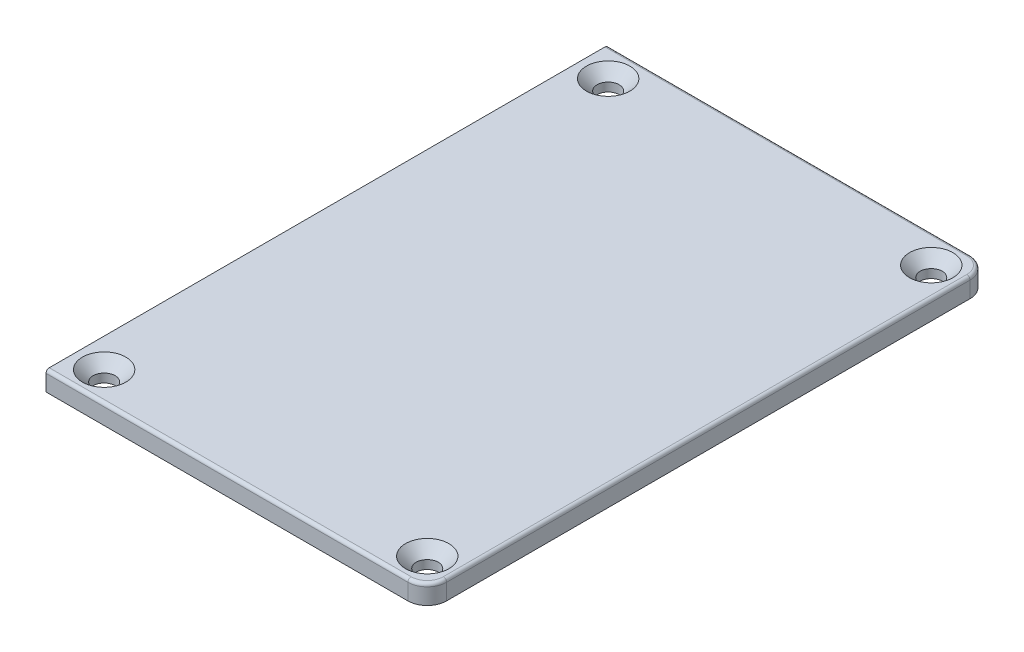
from build123d import *

# Parameters (mm, degrees)
SKETCH1_W                    = 59
SKETCH1_H                    = 87
BOSS_EXTRUDE1_DEPTH          = 1.5
CSK_FOR_M3_SFHCS1_AT_2_COUNT = 2
CSK_FOR_M3_SFHCS1_AT_2_PITCH = 78
CSK_FOR_M3_SFHCS1_AT_3_COUNT = 2
CSK_FOR_M3_SFHCS1_AT_3_PITCH = 92.649878575
CSK_FOR_M3_SFHCS1_AT_4_COUNT = 2
CSK_FOR_M3_SFHCS1_AT_4_PITCH = 50
FILLET3_R                    = 3
FILLET4_R                    = 0.5


with BuildPart() as part:
    # Sketch1 → Boss-Extrude1 (new, symmetric)
    with BuildSketch(Plane(origin=(0, 0, 0), x_dir=(1, 0, 0), z_dir=(0, 1, 0))):
        Rectangle(SKETCH1_W, SKETCH1_H)
    extrude(amount=BOSS_EXTRUDE1_DEPTH, both=True)

    # Sketch4 → CSK for M3 SFHCS1 (revolve, cut)
    with BuildSketch(Plane(origin=(-25, 1.5, -39), x_dir=(0, 0, 1), z_dir=(1, 0, 0))):
        Polygon((0, 0), (0, 3), (1.7, 3), (1.7, 1.66), (3.36, 0), align=None)
    csk_for_m3_sfhcs1 = revolve(axis=Axis((-25, 7.85, -39), (0, -1, 0)), mode=Mode.SUBTRACT)

    # CSK for M3 SFHCS1 at 2: CSK for M3 SFHCS1 ×2
    with Locations(*[(0, 0, i * CSK_FOR_M3_SFHCS1_AT_2_PITCH) for i in range(1, CSK_FOR_M3_SFHCS1_AT_2_COUNT)]):
        add(csk_for_m3_sfhcs1, mode=Mode.SUBTRACT)

    # CSK for M3 SFHCS1 at 3: CSK for M3 SFHCS1 ×2
    with Locations(*[Vector(0.5396661147204319, 0, 0.8418791389638739) * (i * CSK_FOR_M3_SFHCS1_AT_3_PITCH) for i in range(1, CSK_FOR_M3_SFHCS1_AT_3_COUNT)]):
        add(csk_for_m3_sfhcs1, mode=Mode.SUBTRACT)

    # CSK for M3 SFHCS1 at 4: CSK for M3 SFHCS1 ×2
    with Locations(*[(i * CSK_FOR_M3_SFHCS1_AT_4_PITCH, 0, 0) for i in range(1, CSK_FOR_M3_SFHCS1_AT_4_COUNT)]):
        add(csk_for_m3_sfhcs1, mode=Mode.SUBTRACT)

    # Fillet3
    fillet3_edges = [part.edges().sort_by_distance(p)[0] for p in [
        (29.5, 0, 43.5),
        (29.5, 0, -43.5),
    ]]
    fillet(fillet3_edges, radius=FILLET3_R)

    # Fillet4
    fillet4_edges = [part.edges().sort_by_distance(p)[0] for p in [
        (-1.5, 1.5, 43.5),
        (-1.5, 1.5, -43.5),
        (29.5, 1.5, 0),
        (28.621320344, 1.5, 42.621320344),
        (28.621320344, 1.5, -42.621320344),
    ]]
    fillet(fillet4_edges, radius=FILLET4_R)


solid = part.part
